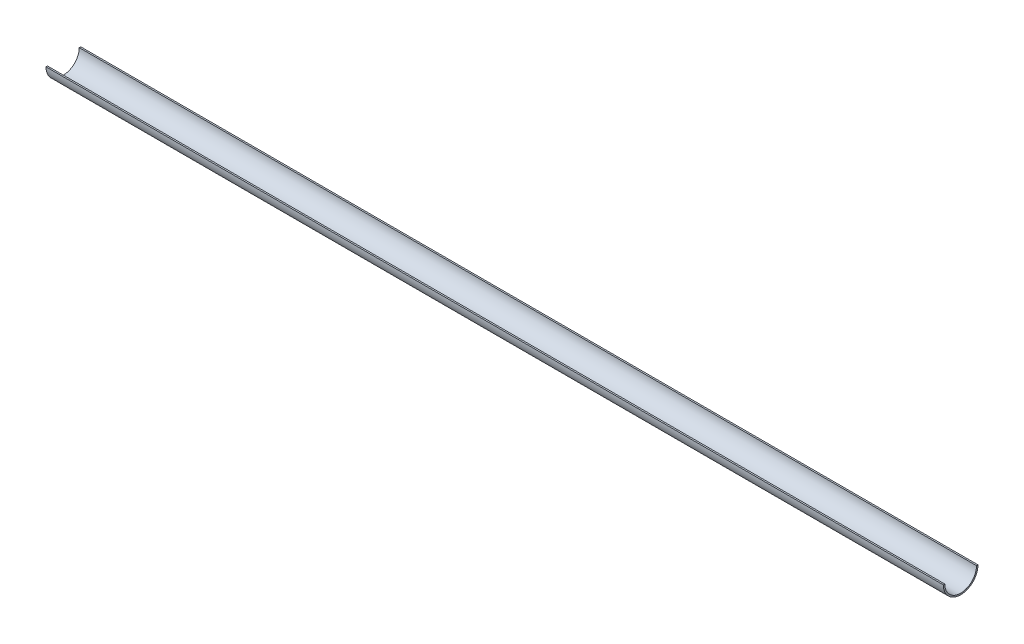
from build123d import *

# Parameters (mm, degrees)
EXTRUDE_1_DEPTH = 6170


with BuildPart() as part:
    # Эскиз1 → Бобышка-Вытянуть1 (new body)
    with BuildSketch(Plane(origin=(0, 0, 0), x_dir=(0, 0, -1), z_dir=(1, 0, 0))):
        with BuildLine():
            Line((119.253358772, 0), (109.186516798, 0))
            ThreePointArc((109.186516798, 0), (0, -109.186516798), (-109.186516798, 0))
            Line((-109.186516798, 0), (-119.253358772, 0))
            ThreePointArc((-119.253358772, 0), (0, -119.253358772), (119.253358772, 0))
        make_face()
    extrude(amount=EXTRUDE_1_DEPTH)


solid = part.part
